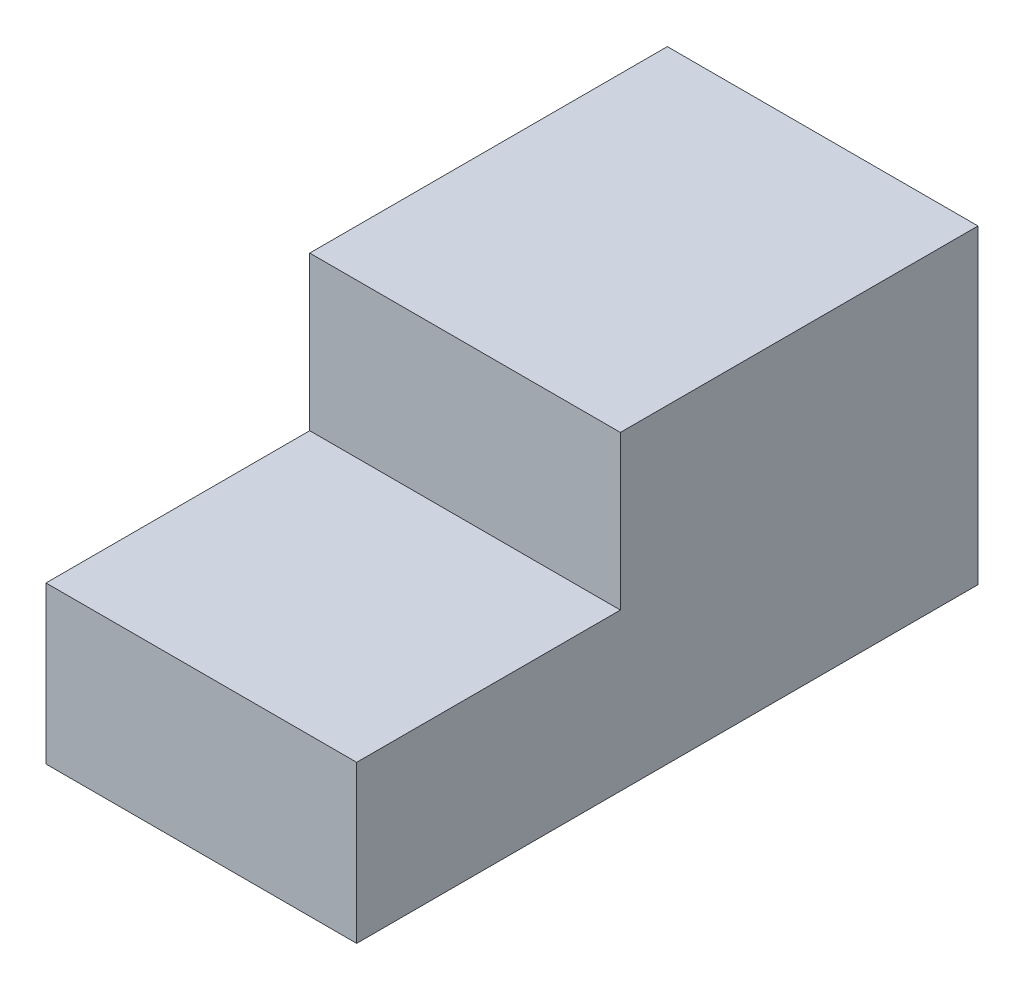
from build123d import *

# Parameters (mm, degrees)
SKETCH1_W           = 2000
SKETCH1_H           = 504.823151126
SKETCH1_W_2         = 1151.125401929
SKETCH1_H_2         = 495.176848874
BOSS_EXTRUDE1_DEPTH = 500


with BuildPart() as part:
    # Sketch1 → Boss-Extrude1 (new, symmetric)
    with BuildSketch(Plane(origin=(0, 0, 0), x_dir=(0, 0, -1), z_dir=(1, 0, 0))):
        Rectangle(SKETCH1_W, SKETCH1_H)
        with Locations((424.437299036, 500)):
            Rectangle(SKETCH1_W_2, SKETCH1_H_2)
    extrude(amount=BOSS_EXTRUDE1_DEPTH, both=True)


solid = part.part
